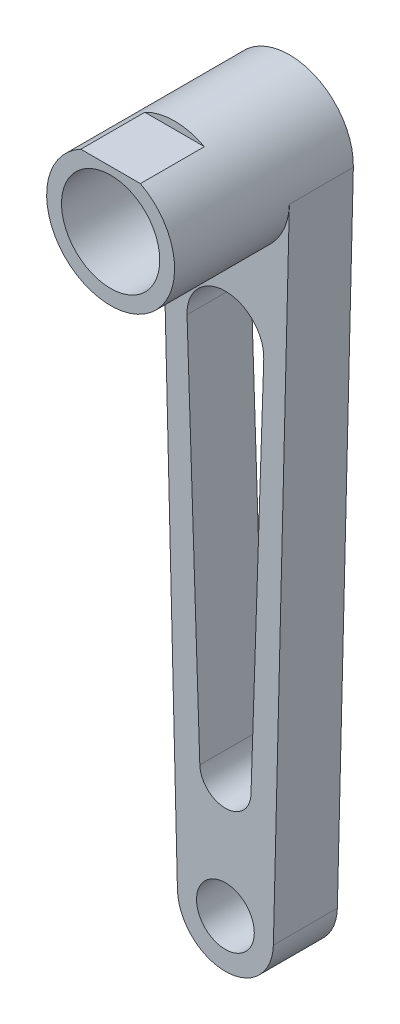
from build123d import *

# Parameters (mm, degrees)
SKETCH1_R           = 4.515
BOSS_EXTRUDE2_DEPTH = 10
SKETCH1_6_R         = 7.675
BOSS_EXTRUDE3_DEPTH = 27.94
SKETCH2_W           = 20.025396677
SKETCH2_H           = 9.808205023
CUT_EXTRUDE1_DEPTH  = 10


with BuildPart() as part:
    # Sketch1 → Boss-Extrude2 (new body)
    with BuildSketch(Plane.XY):
        with BuildLine():
            ThreePointArc((9.996972197, -0.246062766), (5.5e-08, -10), (-9.996972195, -0.246062876))
            Line((-9.996972195, -0.246062876), (-7.497729139, -101.784547426))
            ThreePointArc((-7.497729139, -101.784547426), (1.58e-07, -109.1), (7.497729147, -101.784547111))
            Line((7.497729147, -101.784547111), (9.996972197, -0.246062766))
        make_face()
        with BuildLine():
            Line((5.996665744, -23.199999888), (3.997777167, -83.133333141))
            ThreePointArc((3.997777167, -83.133333141), (1.93e-07, -87), (-3.997777154, -83.133333527))
            Line((-3.997777154, -83.133333527), (-5.996665745, -23.199999845))
            ThreePointArc((-5.996665745, -23.199999845), (2.1e-08, -17), (5.996665744, -23.199999888))
        make_face(mode=Mode.SUBTRACT)
        with Locations((0, -101.6)):
            Circle(SKETCH1_R, mode=Mode.SUBTRACT)
    extrude(amount=BOSS_EXTRUDE2_DEPTH)

    # Sketch1<6> → Boss-Extrude3 (add)
    with BuildSketch(Plane.XY):
        with BuildLine():
            ThreePointArc((10, 0), (-0.123040752, 9.99924302), (-9.996972195, -0.246062876))
            ThreePointArc((-9.996972195, -0.246062876), (5.5e-08, -10), (9.996972197, -0.246062766))
            ThreePointArc((9.996972197, -0.246062766), (9.999243021, -0.123040697), (10, 0))
        make_face()
        Circle(SKETCH1_6_R, mode=Mode.SUBTRACT)
    extrude(amount=BOSS_EXTRUDE3_DEPTH)

    # Sketch2 → Cut-Extrude1 (cut)
    with BuildSketch(Plane.XY.offset(27.94)):
        with Locations((-0.020605473, 13.754102512)):
            Rectangle(SKETCH2_W, SKETCH2_H)
    extrude(amount=-CUT_EXTRUDE1_DEPTH, mode=Mode.SUBTRACT)


solid = part.part
